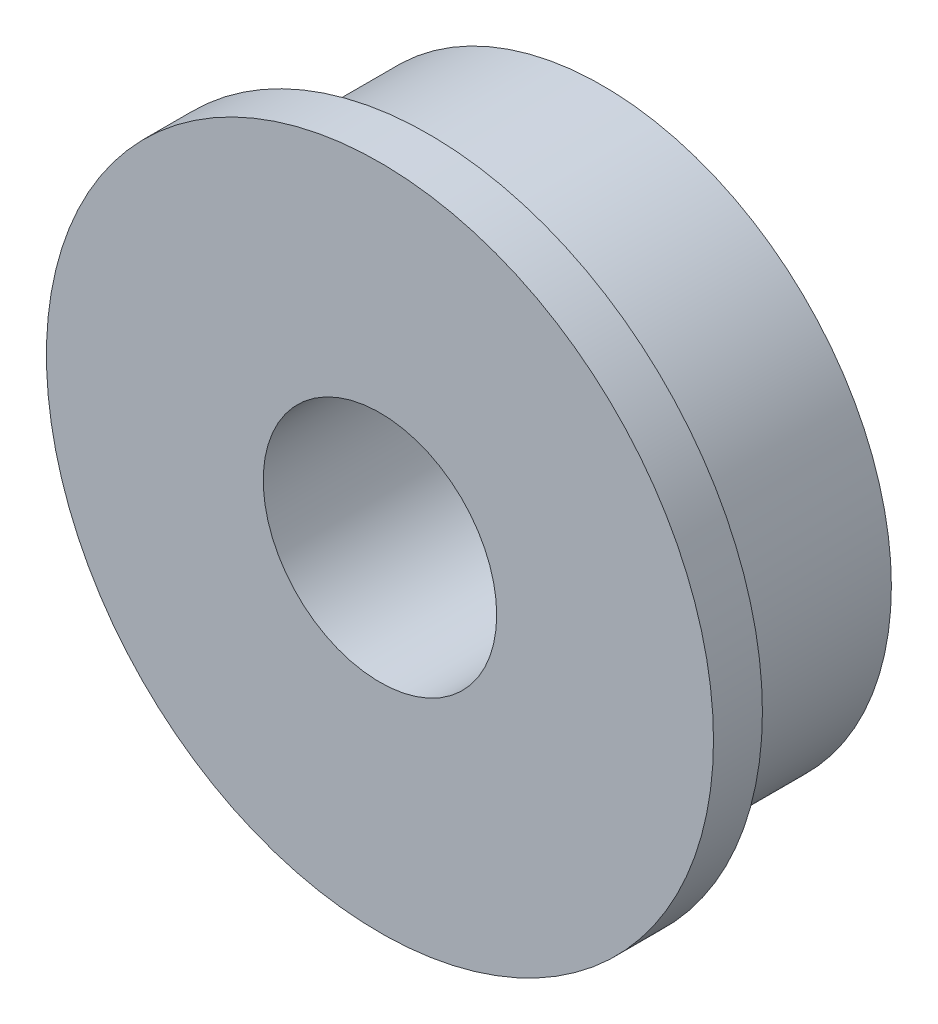
from build123d import *

# Parameters (mm, degrees)
SKETCH_1_R      = 6.5
SKETCH_1_R_2    = 2.625
EXTRUDE_1_DEPTH = 3.9
SKETCH_2_R      = 7.5
SKETCH_2_R_2    = 2.625
EXTRUDE_2_DEPTH = 1.1


with BuildPart() as part:
    # 草图1 → 凸台-拉伸1 (new body)
    with BuildSketch(Plane.XY):
        Circle(SKETCH_1_R)
        Circle(SKETCH_1_R_2, mode=Mode.SUBTRACT)
    extrude(amount=EXTRUDE_1_DEPTH)

    # 草图2 → 凸台-拉伸2 (add)
    with BuildSketch(Plane.XY.offset(3.9)):
        Circle(SKETCH_2_R)
        Circle(SKETCH_2_R_2, mode=Mode.SUBTRACT)
    extrude(amount=EXTRUDE_2_DEPTH)


solid = part.part
